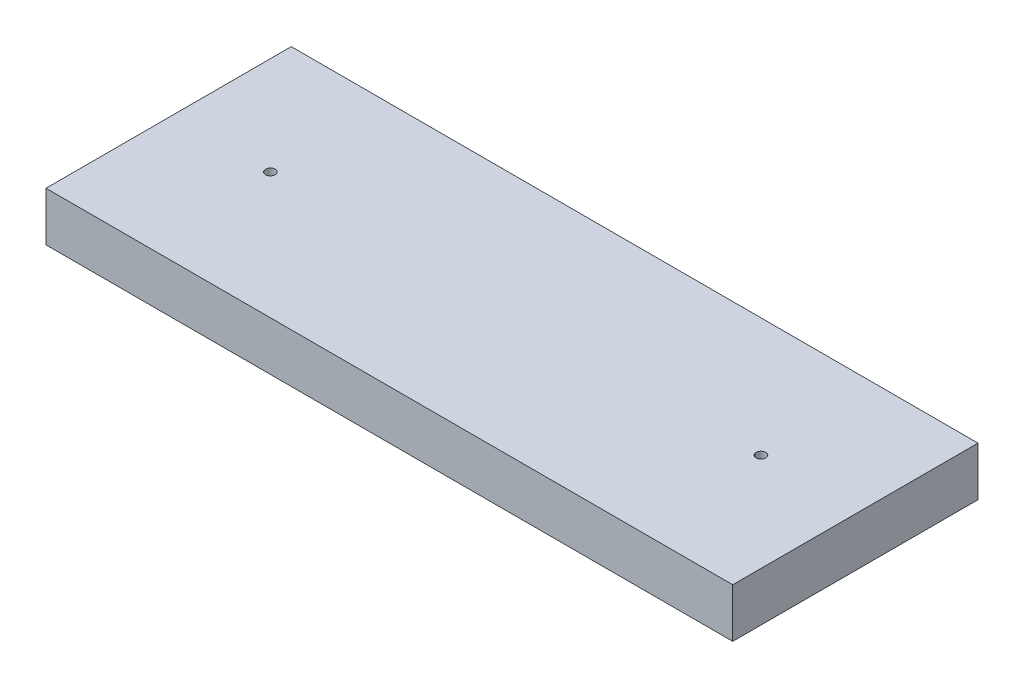
from build123d import *

# Parameters (mm, degrees)
SKETCH1_W              = 711.2
SKETCH1_H              = 254
BOSS_EXTRUDE1_DEPTH    = 50.8
F_10_0MM_DOWEL_HOLE1_D = 10


with BuildPart() as part:
    # Sketch1 → Boss-Extrude1 (new body)
    with BuildSketch(Plane(origin=(0, 0, 0), x_dir=(1, 0, 0), z_dir=(0, 1, 0))):
        Rectangle(SKETCH1_W, SKETCH1_H)
    extrude(amount=BOSS_EXTRUDE1_DEPTH)

    # Ø10.0mm Dowel Hole1 (through all)
    with Locations(Plane(origin=(0, 50.8, 0), x_dir=(1, 0, 0), z_dir=(0, 1, 0))):
        with Locations((-254, 3.81), (254, 3.81)):
            Hole(F_10_0MM_DOWEL_HOLE1_D / 2)


solid = part.part
